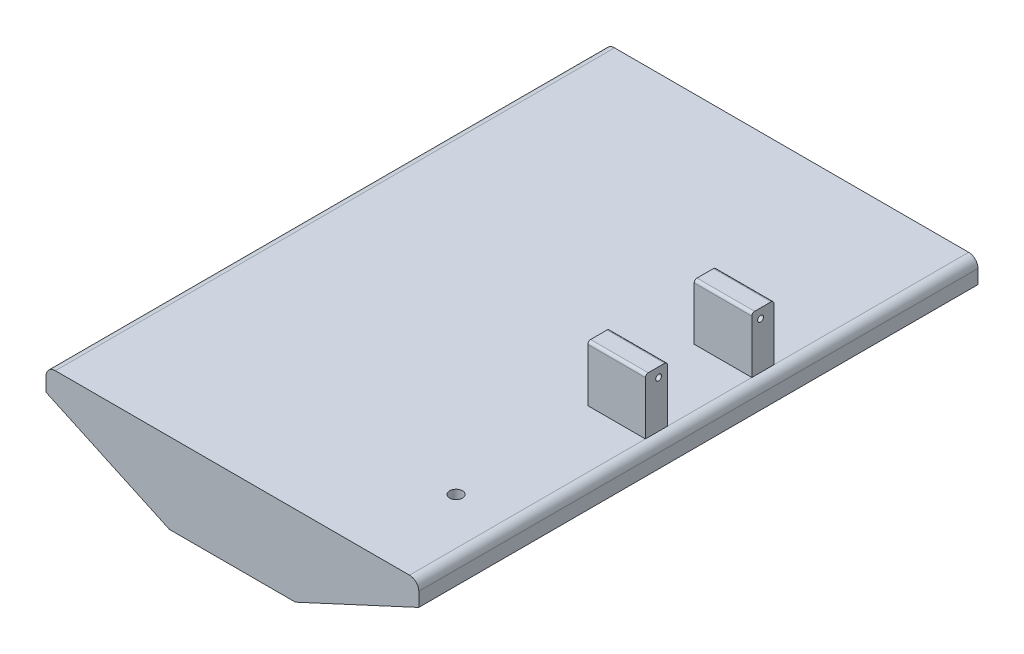
from build123d import *

# Parameters (mm, degrees)
SKETCH2_W               = 101.6
SKETCH2_H               = 6.35
BOSS_EXTRUDE1_DEPTH     = 152.4
CUT_EXTRUDE1_START      = -6.35
SKETCH3_R               = 6.985
CUT_EXTRUDE1_DEPTH      = 157.289355631
CUT_EXTRUDE2_START      = -6.35
SKETCH4_W               = 101.6
SKETCH4_H               = 38.1
CUT_EXTRUDE2_DEPTH      = 157.815347501
FILLET4_R               = 2.54
SKETCH5_W               = 15.7
SKETCH5_H               = 6
BOSS_EXTRUDE2_DEPTH     = 15.24
SKETCH6_R               = 0.8
CUT_EXTRUDE4_DEPTH      = 176.555716512
FILLET7_R               = 0.762
FILLET8_R               = 0.762
TAP_DRILL_FOR_M2_TAP3_D = 1.6
CUT_EXTRUDE5_DEPTH      = 163.639355631
FILLET9_R               = 2.54
BOSS_EXTRUDE3_START     = -57.15
BOSS_EXTRUDE3_DEPTH     = 57.15
CUT_EXTRUDE6_START      = -57.15
CUT_EXTRUDE6_DEPTH      = 57.15
CIRPATTERN1_COUNT       = 30
CUT_EXTRUDE7_START      = -57.15
CUT_EXTRUDE7_DEPTH      = 57.15
BOSS_EXTRUDE7_START     = -57.15
BOSS_EXTRUDE7_DEPTH     = 57.15
SKETCH27_R              = 1.75
CUT_EXTRUDE8_DEPTH      = 164.766410118


with BuildPart() as part:
    # Sketch2 → Boss-Extrude1 (new body)
    with BuildSketch(Plane.XY):
        with BuildLine():
            Line((-50.8, -3.175), (-5.335878714, -24.224686475))
            ThreePointArc((-5.335878714, -24.224686475), (0, -25.4), (5.335878714, -24.224686475))
            Line((5.335878714, -24.224686475), (50.8, -3.175))
            Line((50.8, -3.175), (-50.8, -3.175))
        make_face()
        Rectangle(SKETCH2_W, SKETCH2_H)
    extrude(amount=BOSS_EXTRUDE1_DEPTH)

    # Sketch3 → Cut-Extrude1 (cut, through all)
    with BuildSketch(Plane.XY.offset(152.4).offset(CUT_EXTRUDE1_START)):
        with Locations((0, -12.7)):
            Circle(SKETCH3_R)
    extrude(amount=-CUT_EXTRUDE1_DEPTH, mode=Mode.SUBTRACT)

    # Sketch4 → Cut-Extrude2 (cut, through all)
    with BuildSketch(Plane(origin=(0, 3.175, 0), x_dir=(1, 0, 0), z_dir=(0, 1, 0)).offset(CUT_EXTRUDE2_START)):
        with Locations((0, -76.2)):
            Rectangle(SKETCH4_W, SKETCH4_H)
    extrude(amount=-CUT_EXTRUDE2_DEPTH, mode=Mode.SUBTRACT)

    # Fillet4
    fillet4_edges = [part.edges().sort_by_distance(p)[0] for p in [
        (-50.8, 3.175, 76.2),
        (50.8, 3.175, 76.2),
    ]]
    fillet(fillet4_edges, radius=FILLET4_R)

    # Sketch5 → Boss-Extrude2 (add)
    with BuildSketch(Plane(origin=(0, 3.175, 0), x_dir=(1, 0, 0), z_dir=(0, 1, 0))):
        with Locations((40.41, -85.1)):
            Rectangle(SKETCH5_W, SKETCH5_H)
        with Locations((40.41, -56.1)):
            Rectangle(SKETCH5_W, SKETCH5_H)
    extrude(amount=BOSS_EXTRUDE2_DEPTH)

    # Sketch6 → Cut-Extrude4 (cut, through all)
    with BuildSketch(Plane.ZY.offset(-32.56)):
        with Locations((84.495000084, 15.875)):
            Circle(SKETCH6_R)
        with Locations((56.704999916, 15.875)):
            Circle(SKETCH6_R)
    extrude(amount=-CUT_EXTRUDE4_DEPTH, mode=Mode.SUBTRACT)

    # Fillet7
    fillet7_edges = [part.edges().sort_by_distance(p)[0] for p in [
        (40.41, 18.415, 82.1),
        (40.41, 18.415, 88.1),
    ]]
    fillet(fillet7_edges, radius=FILLET7_R)

    # Fillet8
    fillet8_edges = [part.edges().sort_by_distance(p)[0] for p in [
        (40.41, 18.415, 53.1),
        (40.41, 18.415, 59.1),
    ]]
    fillet(fillet8_edges, radius=FILLET8_R)

    # Tap Drill for M2 Tap3 (through all)
    with Locations(Plane.ZY.offset(-32.56)):
        with Locations((84.495000084, 15.875), (56.704999916, 15.875)):
            Hole(TAP_DRILL_FOR_M2_TAP3_D / 2)

    # Sketch20 → Cut-Extrude5 (cut, through all)
    with BuildSketch(Plane(origin=(0, 0, 0), x_dir=(-1, 0, 0), z_dir=(0, 0, -1))):
        with BuildLine():
            Line((-3.4925, -18.749187445), (-17.162123836, -18.749187445))
            Line((-17.162123836, -18.749187445), (-5.335878714, -24.224686475))
            ThreePointArc((-5.335878714, -24.224686475), (0, -25.4), (5.335878714, -24.224686475))
            Line((5.335878714, -24.224686475), (17.162123836, -18.749187445))
            Line((17.162123836, -18.749187445), (3.4925, -18.749187445))
            ThreePointArc((3.4925, -18.749187445), (0, -19.685), (-3.4925, -18.749187445))
        make_face()
        with BuildLine():
            Line((3.4925, -18.749187445), (-3.4925, -18.749187445))
            ThreePointArc((-3.4925, -18.749187445), (0, -19.685), (3.4925, -18.749187445))
        make_face()
    extrude(amount=-CUT_EXTRUDE5_DEPTH, mode=Mode.SUBTRACT)

    # Fillet9
    fillet9_edges = [part.edges().sort_by_distance(p)[0] for p in [
        (-3.4925, -18.749187445, 120.65),
        (3.4925, -18.749187445, 120.65),
        (3.4925, -18.749187445, 28.575),
        (-3.4925, -18.749187445, 28.575),
    ]]
    fillet(fillet9_edges, radius=FILLET9_R)

    # Sketch22 → Boss-Extrude3 (add)
    with BuildSketch(Plane(origin=(0, 0, 0), x_dir=(-1, 0, 0), z_dir=(0, 0, -1)).offset(BOSS_EXTRUDE3_START)):
        with BuildLine():
            ThreePointArc((6.493675092, -15.273404127), (5.777778675, -8.774761334), (0, -5.715))
            ThreePointArc((0, -5.715), (-5.777778675, -8.774761334), (-6.493675092, -15.273404127))
            ThreePointArc((-6.493675092, -15.273404127), (-6.754001062, -17.63654696), (-8.855011489, -18.749187445))
            Line((-8.855011489, -18.749187445), (-14.812404641, -18.749187445))
            ThreePointArc((-14.812404641, -18.749187445), (0, -28.7), (14.812404641, -18.749187445))
            Line((14.812404641, -18.749187445), (8.855011489, -18.749187445))
            ThreePointArc((8.855011489, -18.749187445), (6.754001062, -17.63654696), (6.493675092, -15.273404127))
        make_face()
    extrude(amount=BOSS_EXTRUDE3_DEPTH)

    # Sketch22<3> → Cut-Extrude6 (cut)
    with BuildSketch(Plane(origin=(0, 0, 0), x_dir=(-1, 0, 0), z_dir=(0, 0, -1)).offset(CUT_EXTRUDE6_START)):
        with BuildLine():
            Line((0, 4.300581709), (0, 3.3))
            ThreePointArc((0, 3.3), (0.611598061, 3.288306596), (1.222302164, 3.253243476))
            ThreePointArc((1.222302164, 3.253243476), (1.616077016, 3.749082227), (2.08, 4.180000044))
            ThreePointArc((2.08, 4.180000044), (1.041746123, 4.270411007), (0, 4.300581709))
        make_face()
        with BuildLine():
            Line((0, 3.175), (0, 0.9))
            Line((0, 0.9), (0.210023287, 0.9))
            ThreePointArc((0.210023287, 0.9), (0.414953438, 0.980902686), (0.509354258, 1.17997578))
            ThreePointArc((0.509354258, 1.17997578), (0.712969262, 2.219570965), (1.170541748, 3.175))
            Line((1.170541748, 3.175), (0, 3.175))
        make_face()
        with BuildLine():
            Line((-0.210023287, 0.9), (0, 0.9))
            Line((0, 0.9), (0, 3.175))
            Line((0, 3.175), (-1.170541748, 3.175))
            ThreePointArc((-1.170541748, 3.175), (-0.712969262, 2.219570965), (-0.509354258, 1.17997578))
            ThreePointArc((-0.509354258, 1.17997578), (-0.414953438, 0.980902686), (-0.210023287, 0.9))
        make_face()
        with BuildLine():
            ThreePointArc((-1.222302164, 3.253243476), (-0.611598061, 3.288306596), (0, 3.3))
            Line((0, 3.3), (0, 4.300581709))
            ThreePointArc((0, 4.300581709), (-1.041746123, 4.270411007), (-2.08, 4.180000044))
            ThreePointArc((-2.08, 4.180000044), (-1.616077016, 3.749082227), (-1.222302164, 3.253243476))
        make_face()
        with BuildLine():
            Line((-1.170541748, 3.175), (0, 3.175))
            Line((0, 3.175), (0, 3.3))
            ThreePointArc((0, 3.3), (-0.611598061, 3.288306596), (-1.222302164, 3.253243476))
            ThreePointArc((-1.222302164, 3.253243476), (-1.196203202, 3.214266451), (-1.170541748, 3.175))
        make_face()
        with BuildLine():
            Line((0, 3.3), (0, 3.175))
            Line((0, 3.175), (1.170541748, 3.175))
            ThreePointArc((1.170541748, 3.175), (1.196203202, 3.214266451), (1.222302164, 3.253243476))
            ThreePointArc((1.222302164, 3.253243476), (0.611598061, 3.288306596), (0, 3.3))
        make_face()
    cut_extrude6 = extrude(amount=CUT_EXTRUDE6_DEPTH, mode=Mode.SUBTRACT)

    # CirPattern1: Cut-Extrude6 ×30 about axis
    cirpattern1_axis = Axis((0, -12.7, 0), (0, 0, 1))
    for i in range(1, CIRPATTERN1_COUNT):
        add(cut_extrude6.rotate(cirpattern1_axis, i * 360 / CIRPATTERN1_COUNT), mode=Mode.SUBTRACT)

    # Sketch23 → Cut-Extrude7 (cut)
    with BuildSketch(Plane(origin=(0, 0, 0), x_dir=(-1, 0, 0), z_dir=(0, 0, -1)).offset(CUT_EXTRUDE7_START)):
        with BuildLine():
            ThreePointArc((-6.493675092, -15.273404127), (0, -19.685), (6.493675092, -15.273404127))
            ThreePointArc((6.493675092, -15.273404127), (6.86106936, -14.009943602), (6.985, -12.7))
            ThreePointArc((6.985, -12.7), (-1.309943602, -5.83893064), (-6.493675092, -15.273404127))
        make_face()
    extrude(amount=CUT_EXTRUDE7_DEPTH, mode=Mode.SUBTRACT)

    # Sketch26 → Boss-Extrude7 (add)
    with BuildSketch(Plane(origin=(0, 0, 0), x_dir=(-1, 0, 0), z_dir=(0, 0, -1)).offset(BOSS_EXTRUDE7_START)):
        with BuildLine():
            Line((50.8, -3.175), (50.8, 0.635))
            ThreePointArc((50.8, 0.635), (50.056051224, 2.431051224), (48.26, 3.175))
            Line((48.26, 3.175), (-6.086772215, 3.175))
            Line((-6.086772215, 3.175), (-48.26, 3.175))
            ThreePointArc((-48.26, 3.175), (-50.056051224, 2.431051224), (-50.8, 0.635))
            Line((-50.8, 0.635), (-50.8, -3.175))
            Line((-50.8, -3.175), (50.8, -3.175))
        make_face()
        with BuildLine():
            Line((17.162123836, -18.749187445), (50.8, -3.175))
            Line((50.8, -3.175), (-50.8, -3.175))
            Line((-50.8, -3.175), (-17.162123836, -18.749187445))
            Line((-17.162123836, -18.749187445), (-8.855011489, -18.749187445))
            ThreePointArc((-8.855011489, -18.749187445), (-6.754001062, -17.63654696), (-6.493675092, -15.273404127))
            ThreePointArc((-6.493675092, -15.273404127), (0, -5.715), (6.493675092, -15.273404127))
            ThreePointArc((6.493675092, -15.273404127), (6.754001062, -17.63654696), (8.855011489, -18.749187445))
            Line((8.855011489, -18.749187445), (17.162123836, -18.749187445))
        make_face()
    extrude(amount=BOSS_EXTRUDE7_DEPTH)

    # Sketch27 → Cut-Extrude8 (cut, through all)
    with BuildSketch(Plane(origin=(0, 3.175, 0), x_dir=(1, 0, 0), z_dir=(0, 1, 0))):
        with Locations(Location((35.56, -127, 0), (0, 0, 270))):
            Circle(SKETCH27_R)
    extrude(amount=-CUT_EXTRUDE8_DEPTH, mode=Mode.SUBTRACT)


solid = part.part
